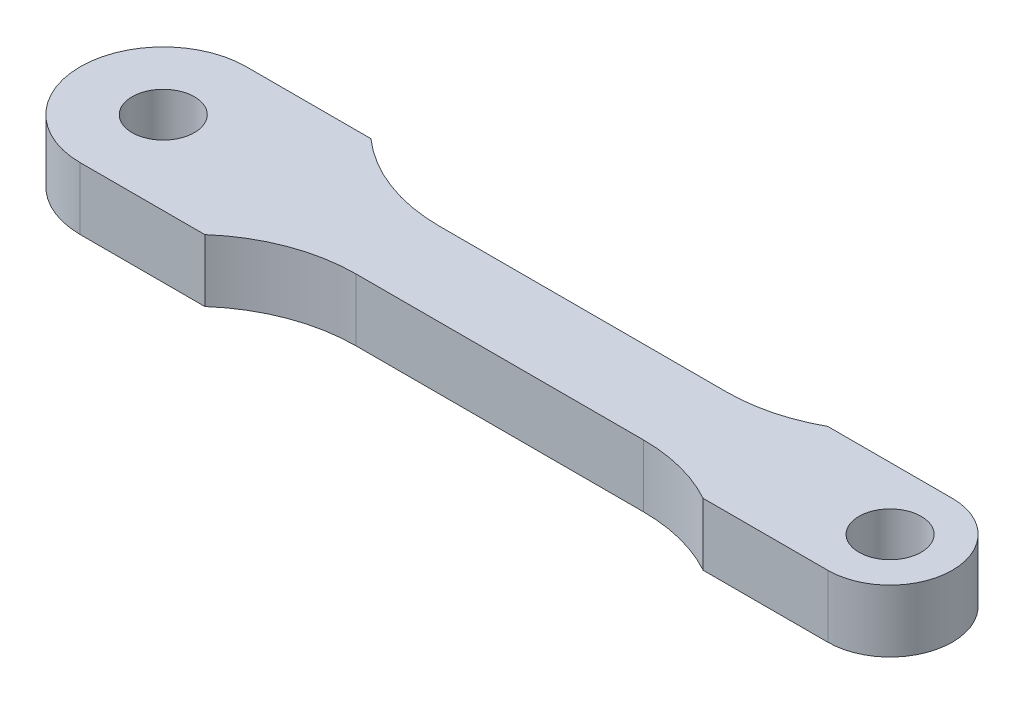
from build123d import *

# Parameters (mm, degrees)
SKETCH1_R           = 1.5
BOSS_EXTRUDE1_DEPTH = 1.5


with BuildPart() as part:
    # Sketch1 → Boss-Extrude1 (new, symmetric)
    with BuildSketch(Plane(origin=(0, 0, 0), x_dir=(1, 0, 0), z_dir=(0, 1, 0))):
        with BuildLine():
            ThreePointArc((-17.5, 4), (-21.5, 0), (-17.5, -4))
            Line((-17.5, -4), (-11.5, -4))
            ThreePointArc((-11.5, -4), (-9.036924503, -2.516685226), (-6.208497378, -2))
            Line((-6.208497378, -2), (7.627016654, -2))
            ThreePointArc((7.627016654, -2), (9.627016654, -2.254033308), (11.5, -3))
            Line((11.5, -3), (17.5, -3))
            ThreePointArc((17.5, -3), (20.5, 0), (17.5, 3))
            Line((17.5, 3), (11.5, 3))
            ThreePointArc((11.5, 3), (9.627016654, 2.254033308), (7.627016654, 2))
            Line((7.627016654, 2), (-6.208497378, 2))
            ThreePointArc((-6.208497378, 2), (-9.036924503, 2.516685226), (-11.5, 4))
            Line((-11.5, 4), (-17.5, 4))
        make_face()
        with Locations((-17.5, 0)):
            Circle(SKETCH1_R, mode=Mode.SUBTRACT)
        with Locations((17.5, 0)):
            Circle(SKETCH1_R, mode=Mode.SUBTRACT)
    extrude(amount=BOSS_EXTRUDE1_DEPTH, both=True)


solid = part.part
